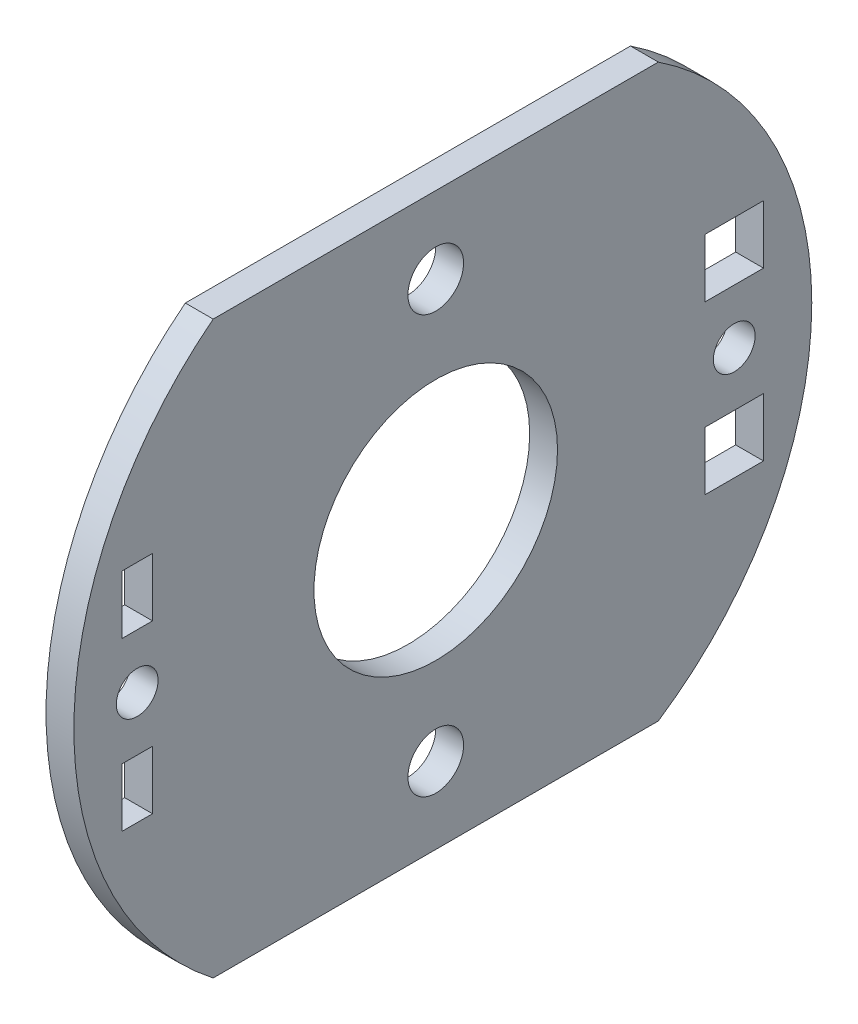
from build123d import *

# Parameters (mm, degrees)
SKETCH_1_R      = 2
SKETCH_1_R_2    = 8.75
SKETCH_1_R_3    = 1.5
SKETCH_1_W      = 2.2
SKETCH_1_H      = 4.2
SKETCH_1_W_2    = 4.2
EXTRUDE_1_DEPTH = 2


with BuildPart() as part:
    # 草图1 → 凸台-拉伸1 (new body)
    with BuildSketch(Plane(origin=(0, 0, 0), x_dir=(0, 0, -1), z_dir=(1, 0, 0))):
        with BuildLine():
            Line((21.45, -20.5), (37.442185592, -20.5))
            ThreePointArc((37.442185592, -20.5), (48.468724148, 0), (37.442185592, 20.5))
            Line((37.442185592, 20.5), (21.45, 20.5))
            Line((21.45, 20.5), (5.457814408, 20.5))
            ThreePointArc((5.457814408, 20.5), (-4.55, 0), (5.457814408, -20.5))
            Line((5.457814408, -20.5), (21.45, -20.5))
        make_face()
        with Locations((21.45, 15)):
            Circle(SKETCH_1_R, mode=Mode.SUBTRACT)
        with Locations((21.45, -15)):
            Circle(SKETCH_1_R, mode=Mode.SUBTRACT)
        with Locations((21.45, 0)):
            Circle(SKETCH_1_R_2, mode=Mode.SUBTRACT)
        Circle(SKETCH_1_R_3, mode=Mode.SUBTRACT)
        with Locations((42.9, 0)):
            Circle(SKETCH_1_R_3, mode=Mode.SUBTRACT)
        with Locations((0, 6)):
            Rectangle(SKETCH_1_W, SKETCH_1_H, mode=Mode.SUBTRACT)
        with Locations((0, -6)):
            Rectangle(SKETCH_1_W, SKETCH_1_H, mode=Mode.SUBTRACT)
        with Locations((42.9, 6)):
            Rectangle(SKETCH_1_W_2, SKETCH_1_H, mode=Mode.SUBTRACT)
        with Locations((42.9, -6)):
            Rectangle(SKETCH_1_W_2, SKETCH_1_H, mode=Mode.SUBTRACT)
    extrude(amount=EXTRUDE_1_DEPTH)


solid = part.part
